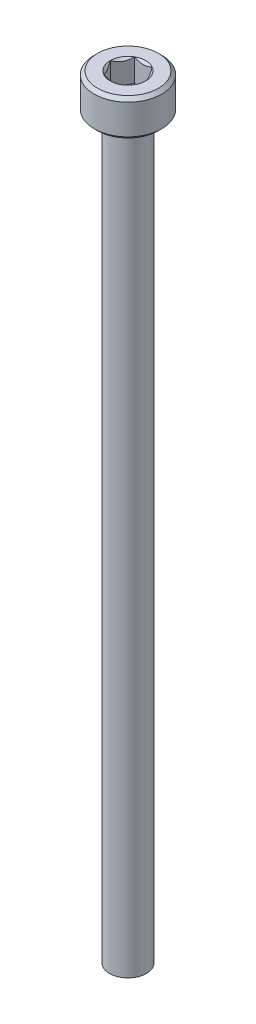
from build123d import *

# Parameters (mm, degrees)
SKETCH1_R           = 2.75
BOSS_EXTRUDE1_DEPTH = 3
CUT_EXTRUDE1_DEPTH  = 1.88
CHAMFER1_SIZE       = 0.275
SKETCH_1_R          = 1.5
EXTRUDE_1_DEPTH     = 60


with BuildPart() as part:
    # Sketch1 → Boss-Extrude1 (new body)
    with BuildSketch(Plane(origin=(0, 0, 0), x_dir=(1, 0, 0), z_dir=(0, 1, 0))):
        with Locations(Location((0, 0, 0), (0, 0, 270))):
            Circle(SKETCH1_R)
    extrude(amount=BOSS_EXTRUDE1_DEPTH)

    # Sketch2 → Cut-Extrude1 (cut)
    with BuildSketch(Plane(origin=(0, 3, 0), x_dir=(1, 0, 0), z_dir=(0, 1, 0))):
        Polygon((0.721687836, 1.25), (-0.721687836, 1.25), (-1.443375673, 0), (-0.721687836, -1.25), (0.721687836, -1.25), (1.443375673, 0), align=None)
    extrude(amount=-CUT_EXTRUDE1_DEPTH, mode=Mode.SUBTRACT)

    # Cut-Extrude2 cone 1 section (through the dimple's axis) → Cut-Extrude2 (revolve, cut)
    with BuildSketch(Plane(origin=(0, 3, 0), x_dir=(0, 0, 1), z_dir=(1, 0, 0))):
        Polygon((0, 0), (1.443375673, 0), (0, 1.443375673), align=None)
    revolve(axis=Axis((0, 3, 0), (0, -1, 0)), mode=Mode.SUBTRACT)

    # Chamfer1
    chamfer1_edges = [part.edges().sort_by_distance(p)[0] for p in [
        (0, 0, -2.75),
        (0, 3, -2.75),
    ]]
    chamfer(chamfer1_edges, length=CHAMFER1_SIZE)

    # 草图1 → 凸台-拉伸1 (add)
    with BuildSketch(Plane(origin=(0, 0, 0), x_dir=(-1, 0, 0), z_dir=(0, -1, 0))):
        with Locations(Location((0, 0, 0), (0, 0, 90))):
            Circle(SKETCH_1_R)
    extrude(amount=EXTRUDE_1_DEPTH)


solid = part.part
